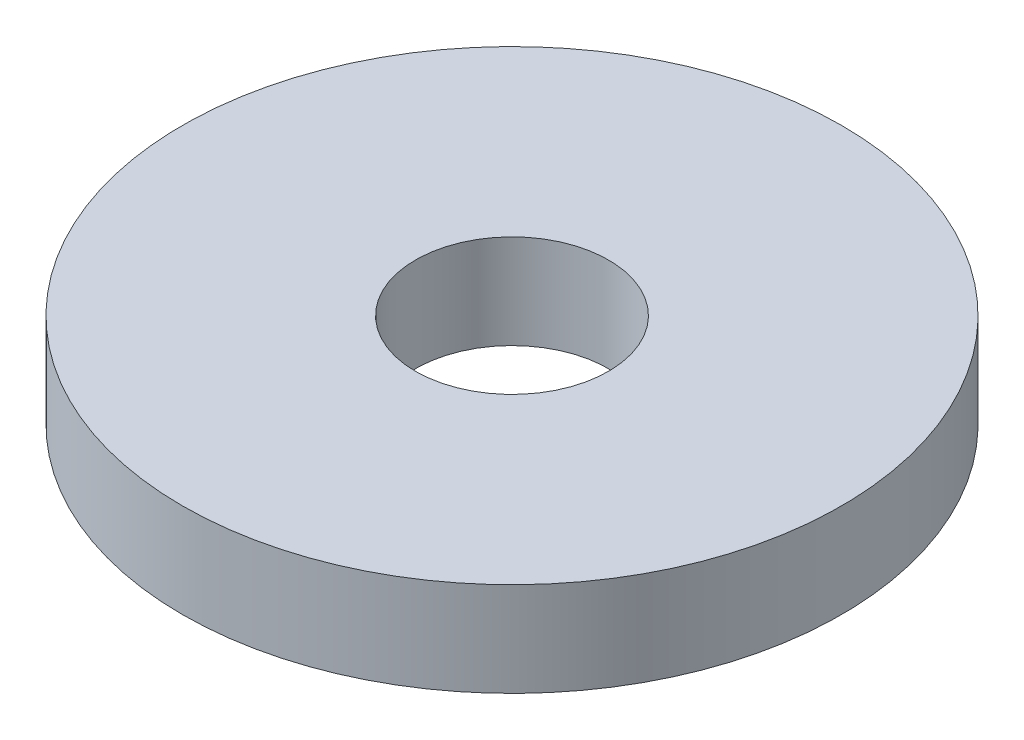
from build123d import *

# Parameters (mm, degrees)
SKETCH_1_R      = 35
SKETCH_1_R_2    = 10.25
EXTRUDE_1_DEPTH = 10


with BuildPart() as part:
    # 草图1 → 凸台-拉伸1 (new body)
    with BuildSketch(Plane(origin=(0, 0, 0), x_dir=(1, 0, 0), z_dir=(0, 1, 0))):
        with Locations(Location((0, 0, 0), (0, 0, 270))):
            Circle(SKETCH_1_R)
        with Locations(Location((0, 0, 0), (0, 0, 270))):
            Circle(SKETCH_1_R_2, mode=Mode.SUBTRACT)
    extrude(amount=EXTRUDE_1_DEPTH)


solid = part.part
